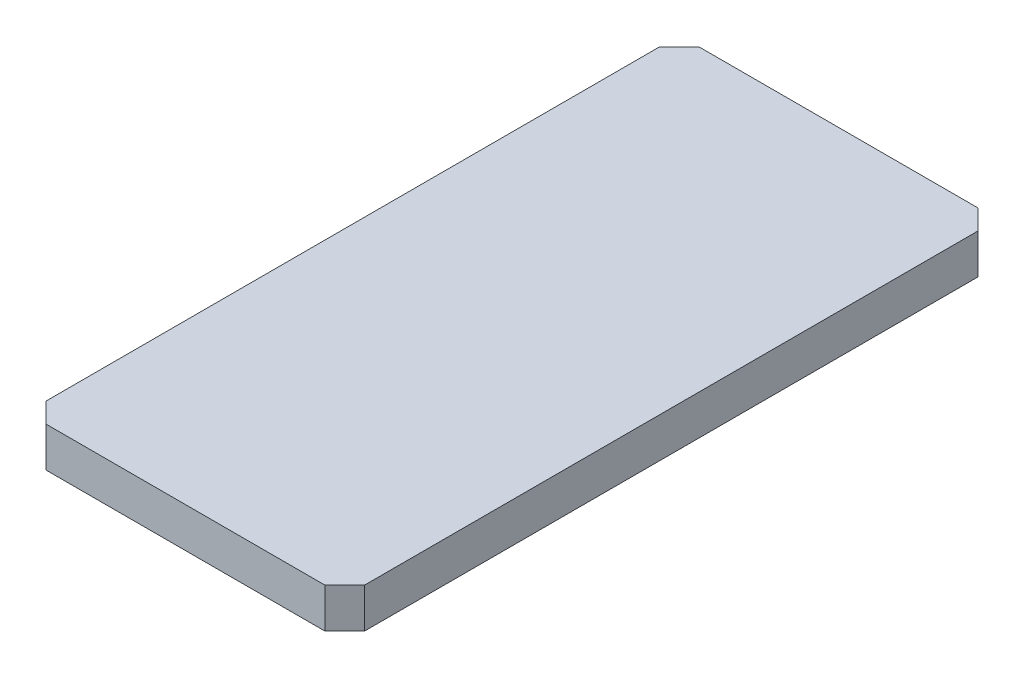
from build123d import *

# Parameters (mm, degrees)
SKETCH1_W           = 40
SKETCH1_H           = 81.992065469
BOSS_EXTRUDE4_DEPTH = 5
CHAMFER3_SIZE       = 2.5
CHAMFER4_SIZE       = 2.5
CHAMFER5_SIZE       = 2.5
CHAMFER6_SIZE       = 2.5
SKETCH5_R           = 1.5
CUT_EXTRUDE5_DEPTH  = 0.5


with BuildPart() as part:
    # Sketch1 → Boss-Extrude4 (new body)
    with BuildSketch(Plane(origin=(0, 0, 0), x_dir=(1, 0, 0), z_dir=(0, 1, 0))):
        with Locations((20, 40.996032735)):
            Rectangle(SKETCH1_W, SKETCH1_H)
    extrude(amount=BOSS_EXTRUDE4_DEPTH)

    # Chamfer3
    chamfer3_edges = [part.edges().sort_by_distance(p)[0] for p in [
        (40, 2.5, -81.992065469),
    ]]
    chamfer(chamfer3_edges, length=CHAMFER3_SIZE)

    # Chamfer4
    chamfer4_edges = [part.edges().sort_by_distance(p)[0] for p in [
        (0, 2.5, -81.992065469),
    ]]
    chamfer(chamfer4_edges, length=CHAMFER4_SIZE)

    # Chamfer5
    chamfer5_edges = [part.edges().sort_by_distance(p)[0] for p in [
        (0, 2.5, 0),
    ]]
    chamfer(chamfer5_edges, length=CHAMFER5_SIZE)

    # Chamfer6
    chamfer6_edges = [part.edges().sort_by_distance(p)[0] for p in [
        (40, 2.5, 0),
    ]]
    chamfer(chamfer6_edges, length=CHAMFER6_SIZE)

    # Sketch5 → Cut-Extrude5 (cut)
    with BuildSketch(Plane(origin=(0, 0, 0), x_dir=(1, 0, 0), z_dir=(0, 1, 0))):
        with BuildLine():
            Line((7.5, 62.992065469), (32.5, 62.992065469))
            ThreePointArc((32.5, 62.992065469), (39.5, 69.992065469), (32.5, 76.992065469))
            Line((32.5, 76.992065469), (7.5, 76.992065469))
            ThreePointArc((7.5, 76.992065469), (0.5, 69.992065469), (7.5, 62.992065469))
        make_face()
        with Locations(Location((36.469361294, 69.992065469, 0), (0, 0, 270))):
            Circle(SKETCH5_R, mode=Mode.SUBTRACT)
    extrude(amount=CUT_EXTRUDE5_DEPTH, mode=Mode.SUBTRACT)


solid = part.part
